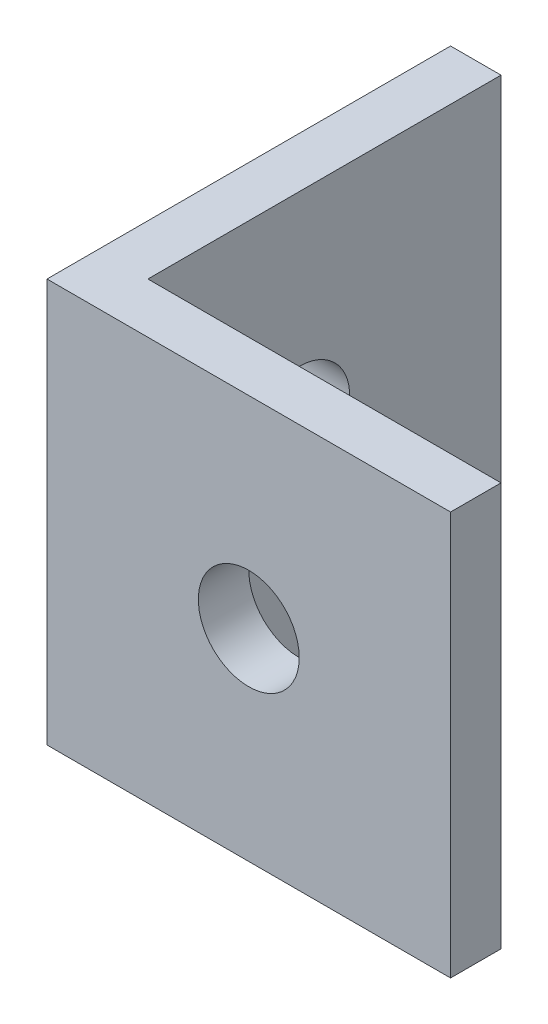
from build123d import *

# Parameters (mm, degrees)
BOSS_EXTRUDE1_DEPTH = 25.4
SKETCH3_R           = 3.175
CUT_EXTRUDE2_DEPTH  = 44.994090512
SKETCH4_R           = 3.175
CUT_EXTRUDE3_DEPTH  = 44.994090512


with BuildPart() as part:
    # Sketch1 → Boss-Extrude1 (new body)
    with BuildSketch(Plane(origin=(0, 0, 0), x_dir=(1, 0, 0), z_dir=(0, 1, 0))):
        Polygon((0, 0), (25.4, 0), (25.4, 3.175), (3.175, 3.175), (3.175, 25.4), (0, 25.4), align=None)
    extrude(amount=BOSS_EXTRUDE1_DEPTH)

    # Sketch3 → Cut-Extrude2 (cut, through all)
    with BuildSketch(Plane.XY):
        with Locations((12.7, 12.7)):
            Circle(SKETCH3_R)
    extrude(amount=-CUT_EXTRUDE2_DEPTH, mode=Mode.SUBTRACT)

    # Sketch4 → Cut-Extrude3 (cut, through all)
    with BuildSketch(Plane.ZY):
        with Locations((-12.7, 12.7)):
            Circle(SKETCH4_R)
    extrude(amount=-CUT_EXTRUDE3_DEPTH, mode=Mode.SUBTRACT)


solid = part.part
